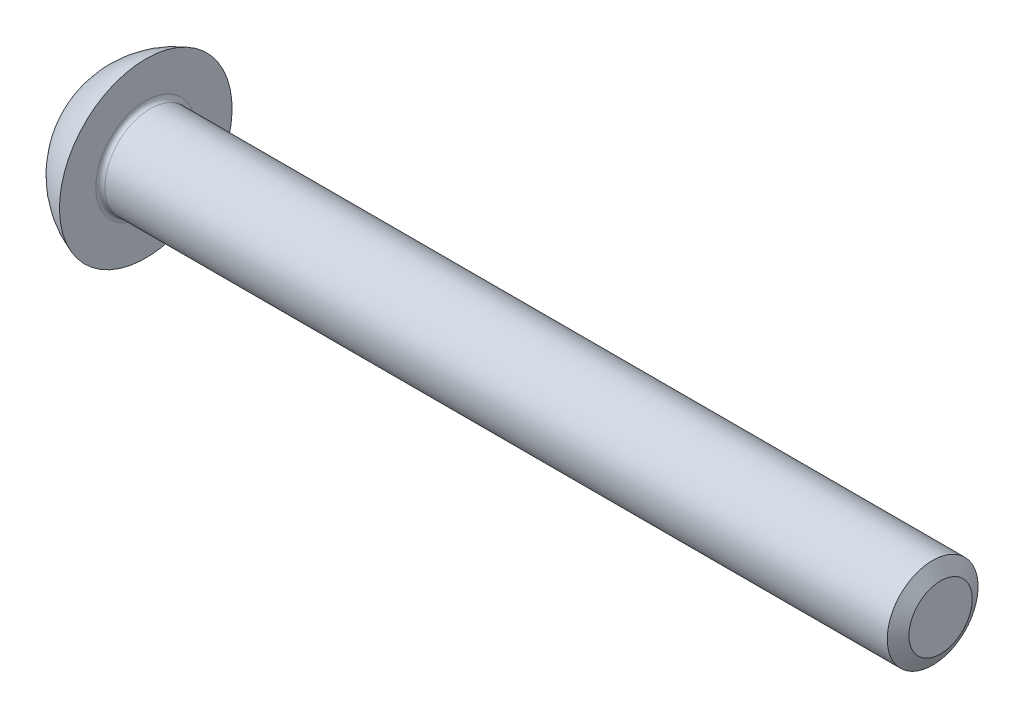
from build123d import *

# Parameters (mm, degrees)
CUT_EXTRUDE_1_DEPTH = 2.2


with BuildPart() as part:
    # 草图1 → 旋转1 (revolve)
    with BuildSketch(Plane.XY):
        with BuildLine():
            Line((0, 2), (-34.8, 2))
            ThreePointArc((-34.8, 2), (-34.941421356, 2.058578644), (-35, 2.2))
            Line((-35, 2.2), (-35, 3.8))
            ThreePointArc((-35, 3.8), (-36.264955669, 3.101612484), (-37.2, 2))
            Line((-37.2, 2), (-37.2, 0))
            Line((-37.2, 0), (0, 0))
            Line((0, 0), (0, 2))
        make_face()
    revolve(axis=Axis((-37.2, 0, 0), (1, 0, 0)))

    # 草图2 → 切除-拉伸1 (cut)
    with BuildSketch(Plane.ZY.offset(37.2)):
        Polygon((0, 1.443375673), (-1.25, 0.721687836), (-1.25, -0.721687836), (0, -1.443375673), (1.25, -0.721687836), (1.25, 0.721687836), align=None)
    extrude(amount=-CUT_EXTRUDE_1_DEPTH, mode=Mode.SUBTRACT)

    # 草图6 → 旋转2 (revolve)
    with BuildSketch(Plane.XY):
        Polygon((-35.9, 1.443375673), (-35, 0), (-34.63, 0), (-34.63, 1.443375673), align=None)
    revolve(axis=Axis((-37.2, 0, 0), (1, 0, 0)))

    # 草图7 → 切除-旋转5 (revolve, cut)
    with BuildSketch(Plane.XY):
        Polygon((-37.2, 1.443375673), (-36.83, 0), (-37.2, 0), align=None)
    revolve(axis=Axis((-37.2, 0, 0), (1, 0, 0)), mode=Mode.SUBTRACT)

    # 草图4 → 切除-旋转1 (revolve, cut)
    with BuildSketch(Plane.XY):
        Polygon((-0.35, 2), (0, 1.393782217), (0.35, 2), align=None)
    revolve(axis=Axis((-0.35, 0, 0), (1, 0, 0)), mode=Mode.SUBTRACT)


solid = part.part
